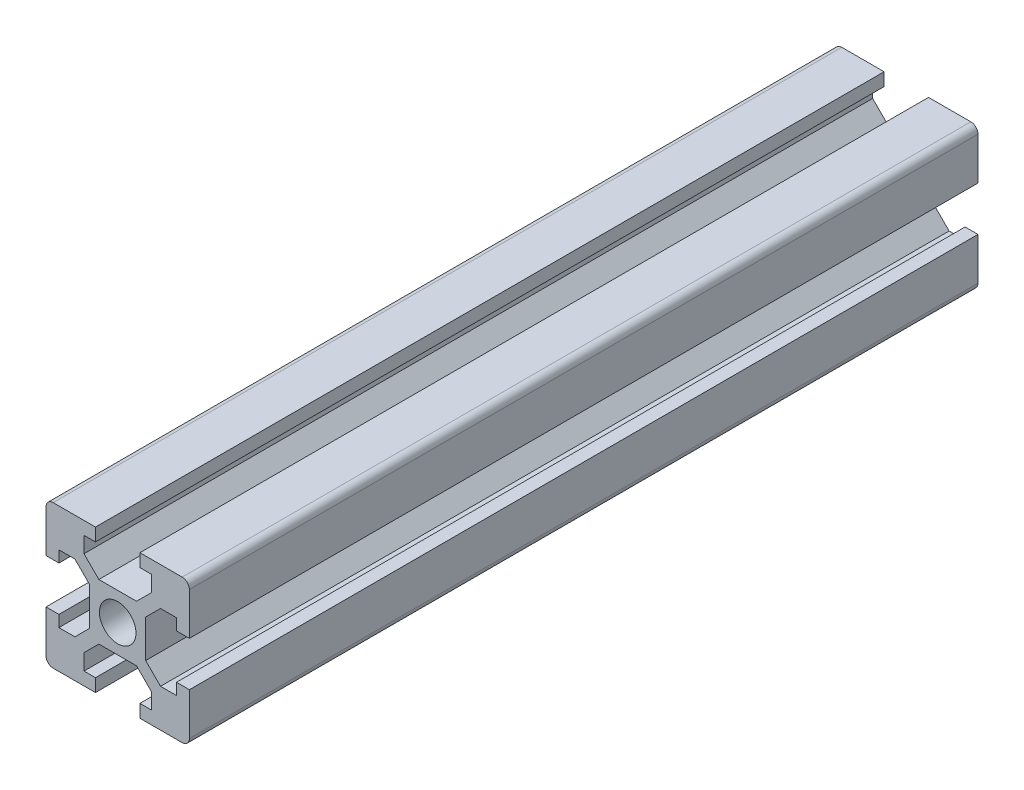
from build123d import *

# Parameters (mm, degrees)
SKETCH_1_R      = 2.55
EXTRUDE_1_DEPTH = 110
FILLET_1_R      = 1


with BuildPart() as part:
    # 草图1 → 凸台-拉伸1 (new body)
    with BuildSketch(Plane.XY):
        Polygon((4.62194142, 1.905266374), (6.694733626, 3.97805858), (6.694733626, 6.205266374), (5.094733626, 6.205266374), (5.094733626, 8.005266374), (11.994733626, 8.005266374), (11.994733626, 1.105266374), (10.194733626, 1.105266374), (10.194733626, 2.705266374), (7.967525833, 2.705266374), (5.894733626, 0.632474167), (5.894733626, -4.62194142), (7.967525833, -6.694733626), (10.194733626, -6.694733626), (10.194733626, -5.094733626), (11.994733626, -5.094733626), (11.994733626, -11.994733626), (5.094733626, -11.994733626), (5.094733626, -10.194733626), (6.694733626, -10.194733626), (6.694733626, -7.967525833), (4.62194142, -5.894733626), (-0.632474167, -5.894733626), (-2.705266374, -7.967525833), (-2.705266374, -10.194733626), (-1.105266374, -10.194733626), (-1.105266374, -11.994733626), (-8.005266374, -11.994733626), (-8.005266374, -5.094733626), (-6.205266374, -5.094733626), (-6.205266374, -6.694733626), (-3.97805858, -6.694733626), (-1.905266374, -4.62194142), (-1.905266374, 0.632474167), (-3.97805858, 2.705266374), (-6.205266374, 2.705266374), (-6.205266374, 1.105266374), (-8.005266374, 1.105266374), (-8.005266374, 8.005266374), (-1.105266374, 8.005266374), (-1.105266374, 6.205266374), (-2.705266374, 6.205266374), (-2.705266374, 3.97805858), (-0.632474167, 1.905266374), align=None)
        with Locations((1.994733626, -1.994733626)):
            Circle(SKETCH_1_R, mode=Mode.SUBTRACT)
    extrude(amount=EXTRUDE_1_DEPTH)

    # 圆角1
    fillet_1_edges = [part.edges().sort_by_distance(p)[0] for p in [
        (-8.005266374, -11.994733626, 55),
        (-8.005266374, 8.005266374, 55),
        (11.994733626, 8.005266374, 55),
        (11.994733626, -11.994733626, 55),
    ]]
    fillet(fillet_1_edges, radius=FILLET_1_R)


solid = part.part
